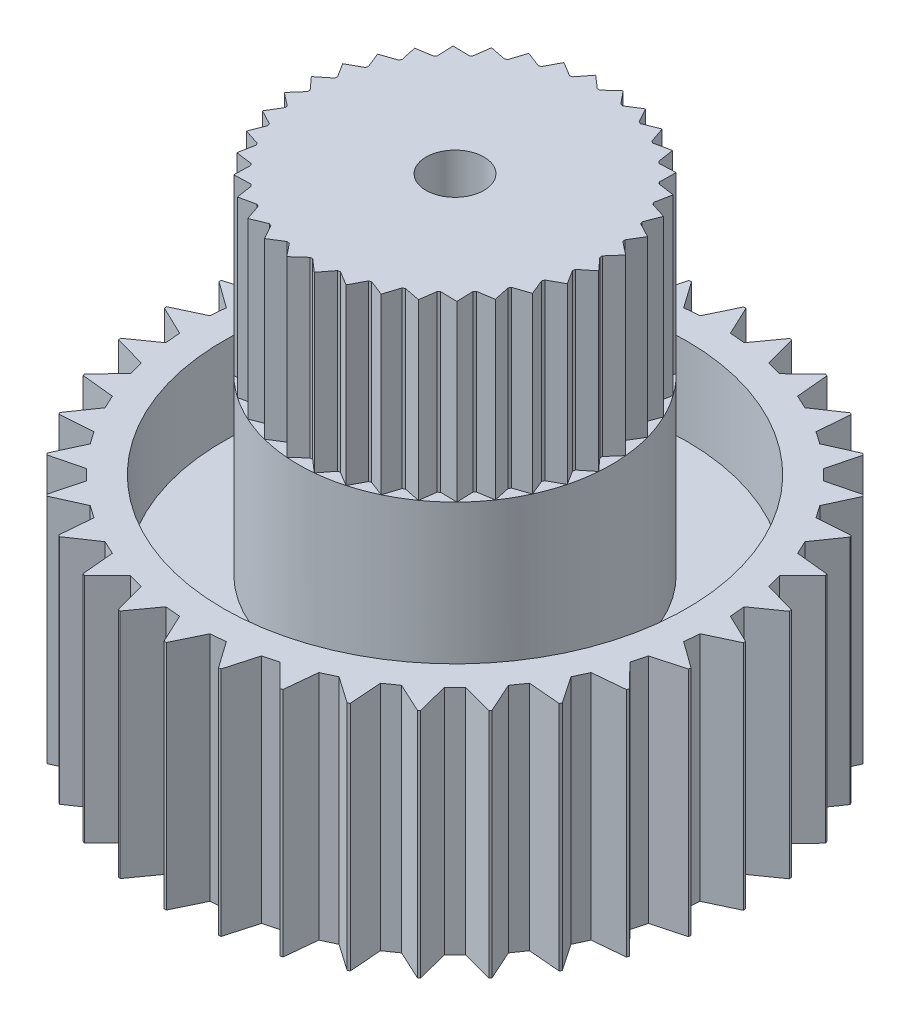
from build123d import *

# Parameters (mm, degrees)
SKETCH2_R           = 5
BOSS_EXTRUDE1_DEPTH = 4
CUT_EXTRUDE1_DEPTH  = 9.124038405
CIRPATTERN1_COUNT   = 36
SKETCH6_R           = 4
CUT_EXTRUDE2_DEPTH  = 1.5
SKETCH7_R           = 0.5
CUT_EXTRUDE3_DEPTH  = 9.124038405
CUT_EXTRUDE4_START  = -1.5
SKETCH8_R           = 4
SKETCH8_R_2         = 1
CUT_EXTRUDE4_DEPTH  = 1.5
SKETCH9_R           = 2.5
BOSS_EXTRUDE2_DEPTH = 6
SKETCH10_R          = 0.5
CUT_EXTRUDE5_DEPTH  = 12.056672194
BOSS_EXTRUDE3_DEPTH = 3
CIRPATTERN2_COUNT   = 36
SKETCH13_R          = 2.7
BOSS_EXTRUDE4_DEPTH = 3


with BuildPart() as part:
    # Sketch2 → Boss-Extrude1 (new body)
    with BuildSketch(Plane(origin=(0, 0, 0), x_dir=(1, 0, 0), z_dir=(0, 1, 0))):
        with Locations(Location((0, 0, 0), (0, 0, 270))):
            Circle(SKETCH2_R)
    extrude(amount=BOSS_EXTRUDE1_DEPTH)

    # Sketch4 → Cut-Extrude1 (cut, through all)
    with BuildSketch(Plane(origin=(0, 4, 0), x_dir=(1, 0, 0), z_dir=(0, 1, 0))):
        Polygon((0.26165173, 4.492386712), (0, 5.048851691), (0.874121418, 4.957388906), (0.522418114, 4.46957261), align=None)
    cut_extrude1 = extrude(amount=-CUT_EXTRUDE1_DEPTH, mode=Mode.SUBTRACT)

    # CirPattern1: Cut-Extrude1 ×36 about axis
    cirpattern1_axis = Axis((0, 0, 0), (0, 1, 0))
    for i in range(1, CIRPATTERN1_COUNT):
        add(cut_extrude1.rotate(cirpattern1_axis, i * 360 / CIRPATTERN1_COUNT), mode=Mode.SUBTRACT)

    # Sketch6 → Cut-Extrude2 (cut)
    with BuildSketch(Plane(origin=(0, 4, 0), x_dir=(1, 0, 0), z_dir=(0, 1, 0))):
        with Locations(Location((0, 0, 0), (0, 0, 270))):
            Circle(SKETCH6_R)
    extrude(amount=-CUT_EXTRUDE2_DEPTH, mode=Mode.SUBTRACT)

    # Sketch7 → Cut-Extrude3 (cut, through all)
    with BuildSketch(Plane(origin=(0, 4, 0), x_dir=(1, 0, 0), z_dir=(0, 1, 0))):
        with Locations(Location((0, 0, 0), (0, 0, 270))):
            Circle(SKETCH7_R)
    extrude(amount=-CUT_EXTRUDE3_DEPTH, mode=Mode.SUBTRACT)

    # Sketch8 → Cut-Extrude4 (cut)
    with BuildSketch(Plane(origin=(0, 0, 0), x_dir=(-1, 0, 0), z_dir=(0, -1, 0)).offset(CUT_EXTRUDE4_START)):
        with Locations(Location((0, 0, 0), (0, 0, 270))):
            Circle(SKETCH8_R)
        with Locations(Location((0, 0, 0), (0, 0, 90))):
            Circle(SKETCH8_R_2, mode=Mode.SUBTRACT)
    extrude(amount=CUT_EXTRUDE4_DEPTH, mode=Mode.SUBTRACT)

    # Sketch9 → Boss-Extrude2 (add)
    with BuildSketch(Plane(origin=(0, 2.5, 0), x_dir=(1, 0, 0), z_dir=(0, 1, 0))):
        with Locations(Location((0, 0, 0), (0, 0, 270))):
            Circle(SKETCH9_R)
    extrude(amount=BOSS_EXTRUDE2_DEPTH)

    # Sketch10 → Cut-Extrude5 (cut, through all)
    with BuildSketch(Plane(origin=(0, 8.5, 0), x_dir=(1, 0, 0), z_dir=(0, 1, 0))):
        with Locations(Location((0, 0, 0), (0, 0, 270))):
            Circle(SKETCH10_R)
    extrude(amount=-CUT_EXTRUDE5_DEPTH, mode=Mode.SUBTRACT)

    # Sketch12 → Boss-Extrude3 (add)
    with BuildSketch(Plane(origin=(0, 8.5, 0), x_dir=(1, 0, 0), z_dir=(0, 1, 0))):
        Polygon((2.469220851, -0.391086163), (2.691676801, -0.211839558), (2.5, 0), align=None)
    boss_extrude3 = extrude(amount=-BOSS_EXTRUDE3_DEPTH)

    # CirPattern2: Boss-Extrude3 ×36 about axis
    cirpattern2_axis = Axis((0, 0, 0), (0, 1, 0))
    for i in range(1, CIRPATTERN2_COUNT):
        add(boss_extrude3.rotate(cirpattern2_axis, i * 360 / CIRPATTERN2_COUNT))

    # Sketch13 → Boss-Extrude4 (add)
    with BuildSketch(Plane(origin=(0, 2.5, 0), x_dir=(1, 0, 0), z_dir=(0, 1, 0))):
        with Locations(Location((0, 0, 0), (0, 0, 85.5))):
            Circle(SKETCH13_R)
    extrude(amount=BOSS_EXTRUDE4_DEPTH)


solid = part.part
